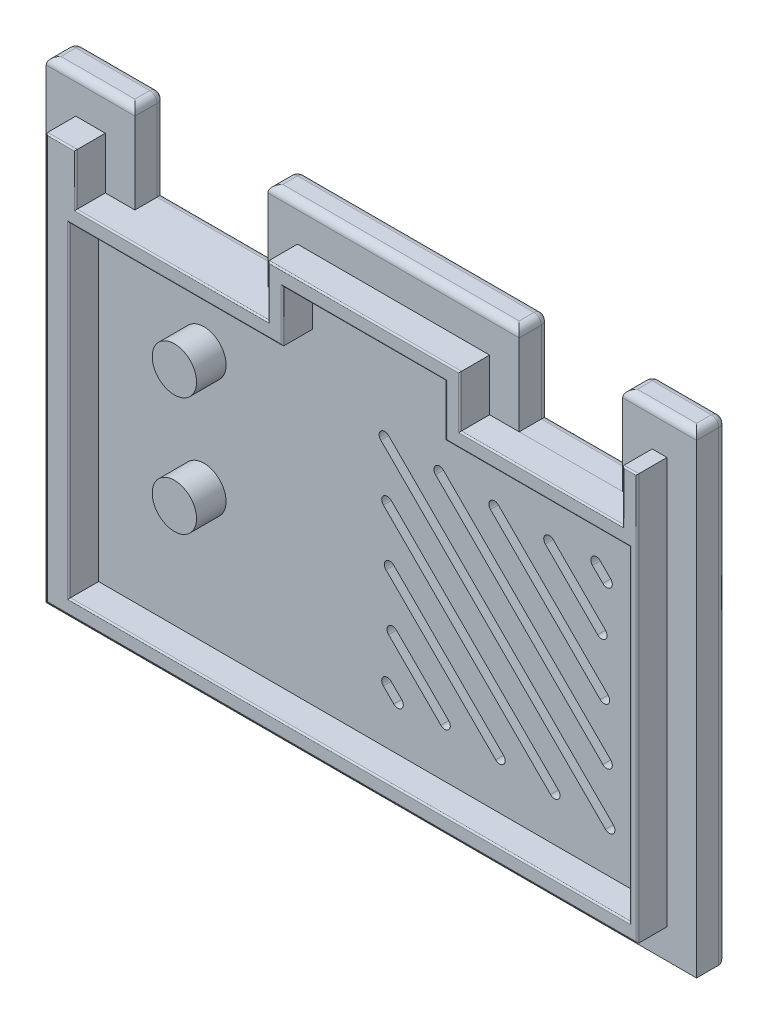
from build123d import *

# Parameters (mm, degrees)
BOSS_EXTRUDE1_DEPTH = 2
FILLET1_R           = 0.5
BOSS_EXTRUDE2_DEPTH = 2
FILLET4_R           = 0.1
SKETCH3_R           = 1.5
BOSS_EXTRUDE3_DEPTH = 2
CUT_EXTRUDE4_DEPTH  = 2


with BuildPart() as part:
    # Sketch1 → Boss-Extrude1 (new body)
    with BuildSketch(Plane.XY):
        Polygon((-16, 16), (-16, 10), (-7, 10), (-7, 16), (10, 16), (10, 10), (17, 10), (17, 16), (22, 16), (22, -16), (-22, -16), (-22, 16), align=None)
    extrude(amount=BOSS_EXTRUDE1_DEPTH)

    # Fillet1
    fillet1_edges = [part.edges().sort_by_distance(p)[0] for p in [
        (22, 0, 0),
        (0, -16, 0),
        (-22, 0, 0),
        (-19, 16, 0),
        (-16, 13, 0),
        (-11.5, 10, 0),
        (-7, 13, 0),
        (1.5, 16, 0),
        (10, 13, 0),
        (13.5, 10, 0),
        (17, 13, 0),
        (19.5, 16, 0),
        (22, 16, 1),
        (1.5, 16, 2),
        (-22, 16, 1),
        (-16, 16, 1),
        (-7, 16, 1),
        (10, 16, 1),
        (17, 16, 1),
        (-19, 16, 2),
        (19.5, 16, 2),
    ]]
    fillet(fillet1_edges, radius=FILLET1_R)

    # Sketch2 → Boss-Extrude2 (add)
    with BuildSketch(Plane.XY.offset(2)):
        Polygon((20, 13.5), (19, 13.5), (19, 10.002928169), (8, 10.002928169), (8, 13.5), (-5, 13.5), (-5, 10), (-18, 10), (-18, 13.5), (-20, 13.5), (-20, -14), (20, -14), align=None)
        Polygon((7, 9.002928169), (19.458039892, 9.002928169), (19.458533352, -13), (19, -13), (-18.458039892, -13), (-18.458039892, 9.002928169), (-4, 9.002928169), (-4, 12.5), (7, 12.5), align=None, mode=Mode.SUBTRACT)
    extrude(amount=BOSS_EXTRUDE2_DEPTH)

    # Fillet4
    fillet4_edges = [part.edges().sort_by_distance(p)[0] for p in [
        (13.5, 10.002928169, 4),
        (8, 11.751464084, 4),
        (1.5, 13.5, 4),
        (-5, 11.75, 4),
        (-11.5, 10, 4),
        (-18, 11.75, 4),
        (-19, 13.5, 4),
        (-20, -0.25, 4),
        (0, -14, 4),
        (20, -0.25, 4),
        (19.5, 13.5, 4),
        (19, 11.751464084, 4),
        (-4, 10.751464084, 4),
        (-11.229019946, 9.002928169, 4),
        (-18.458039892, -1.998535916, 4),
        (0.50024673, -13, 4),
        (19.458286622, -1.998535916, 4),
        (13.229019946, 9.002928169, 4),
        (7, 10.751464084, 4),
        (1.5, 12.5, 4),
    ]]
    fillet(fillet4_edges, radius=FILLET4_R)

    # Sketch3 → Boss-Extrude3 (add)
    with BuildSketch(Plane.XY.offset(2)):
        with Locations((-11.329019946, 4)):
            Circle(SKETCH3_R)
        with Locations((-11.329019946, -4)):
            Circle(SKETCH3_R)
    extrude(amount=BOSS_EXTRUDE3_DEPTH)

    # Sketch4 → Cut-Extrude4 (cut)
    with BuildSketch(Plane.XY.offset(2)):
        with BuildLine():
            Line((16.189786245, 4.482679464), (15.482679464, 5.189786245))
            ThreePointArc((15.482679464, 5.189786245), (14.952349378, 5.189786245), (14.952349378, 4.65945616))
            Line((14.952349378, 4.65945616), (15.65945616, 3.952349378))
            ThreePointArc((15.65945616, 3.952349378), (16.189786245, 3.952349378), (16.189786245, 4.482679464))
        make_face()
        with BuildLine():
            Line((15.836232855, 1.300698949), (12.300698949, 4.836232855))
            ThreePointArc((12.300698949, 4.836232855), (11.770368863, 4.836232855), (11.770368863, 4.305902769))
            Line((11.770368863, 4.305902769), (15.305902769, 0.770368863))
            ThreePointArc((15.305902769, 0.770368863), (15.836232855, 0.770368863), (15.836232855, 1.300698949))
        make_face()
        with BuildLine():
            Line((16.01300955, -2.411611652), (8.588388348, 5.01300955))
            ThreePointArc((8.588388348, 5.01300955), (8.058058262, 5.01300955), (8.058058262, 4.482679464))
            Line((8.058058262, 4.482679464), (15.482679464, -2.941941738))
            ThreePointArc((15.482679464, -2.941941738), (16.01300955, -2.941941738), (16.01300955, -2.411611652))
        make_face()
        with BuildLine():
            Line((16.189786245, -6.123922254), (4.876077746, 5.189786245))
            ThreePointArc((4.876077746, 5.189786245), (4.345747661, 5.189786245), (4.345747661, 4.65945616))
            Line((4.345747661, 4.65945616), (15.65945616, -6.654252339))
            ThreePointArc((15.65945616, -6.654252339), (16.189786245, -6.654252339), (16.189786245, -6.123922254))
        make_face()
        with BuildLine():
            Line((0.633437059, 4.836232855), (15.836232855, -10.366562941))
            ThreePointArc((15.836232855, -10.366562941), (16.366562941, -10.366562941), (16.366562941, -9.836232855))
            Line((16.366562941, -9.836232855), (1.163767145, 5.366562941))
            ThreePointArc((1.163767145, 5.366562941), (0.633437059, 5.366562941), (0.633437059, 4.836232855))
        make_face()
        with BuildLine():
            ThreePointArc((0.810213755, 1.123922254), (0.810213755, 1.654252339), (1.34054384, 1.654252339))
            Line((1.34054384, 1.654252339), (12.654252339, -9.65945616))
            ThreePointArc((12.654252339, -9.65945616), (12.654252339, -10.189786245), (12.123922254, -10.189786245))
            Line((12.123922254, -10.189786245), (0.810213755, 1.123922254))
        make_face()
        with BuildLine():
            ThreePointArc((0.98699045, -2.588388348), (0.98699045, -2.058058262), (1.517320536, -2.058058262))
            Line((1.517320536, -2.058058262), (8.941941738, -9.482679464))
            ThreePointArc((8.941941738, -9.482679464), (8.941941738, -10.01300955), (8.411611652, -10.01300955))
            Line((8.411611652, -10.01300955), (0.98699045, -2.588388348))
        make_face()
        with BuildLine():
            ThreePointArc((1.163767145, -6.300698949), (1.163767145, -5.770368863), (1.694097231, -5.770368863))
            Line((1.694097231, -5.770368863), (5.229631137, -9.305902769))
            ThreePointArc((5.229631137, -9.305902769), (5.229631137, -9.836232855), (4.699301051, -9.836232855))
            Line((4.699301051, -9.836232855), (1.163767145, -6.300698949))
        make_face()
        with BuildLine():
            ThreePointArc((0.810213755, -9.482679464), (0.810213755, -8.952349378), (1.34054384, -8.952349378))
            Line((1.34054384, -8.952349378), (2.047650622, -9.65945616))
            ThreePointArc((2.047650622, -9.65945616), (2.047650622, -10.189786245), (1.517320536, -10.189786245))
            Line((1.517320536, -10.189786245), (0.810213755, -9.482679464))
        make_face()
    extrude(amount=-CUT_EXTRUDE4_DEPTH, mode=Mode.SUBTRACT)


solid = part.part
